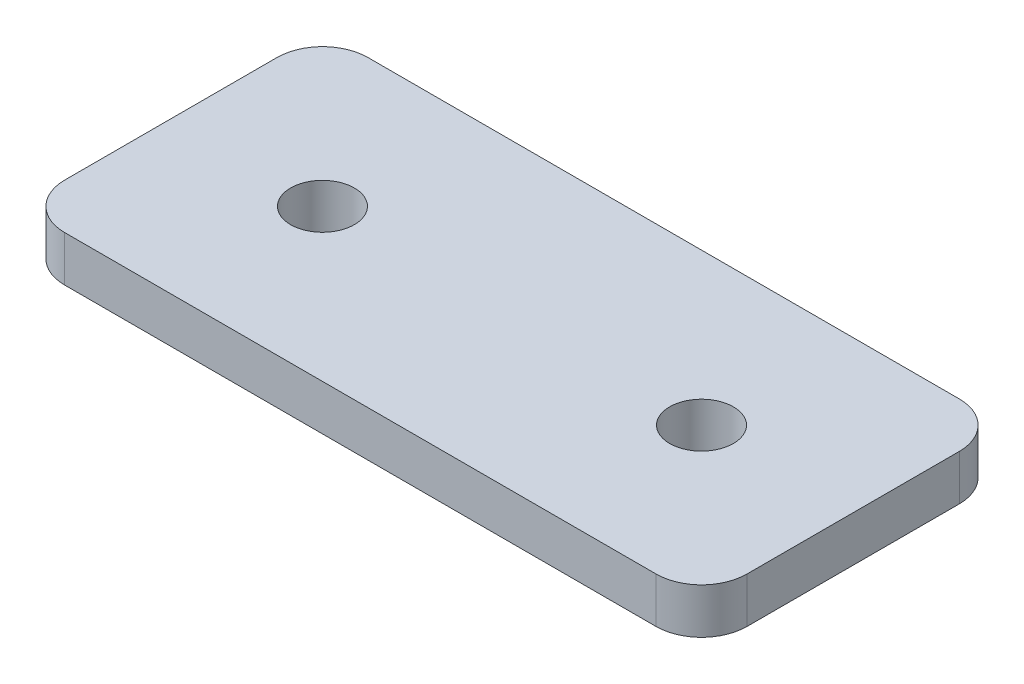
from build123d import *

# Parameters (mm, degrees)
SKETCH_1_W      = 45
SKETCH_1_H      = 20
SKETCH_1_R      = 2.1
EXTRUDE_1_DEPTH = 3
FILLET_1_R      = 3


with BuildPart() as part:
    # 草图1 → 凸台-拉伸1 (new body)
    with BuildSketch(Plane(origin=(0, 0, 0), x_dir=(1, 0, 0), z_dir=(0, 1, 0))):
        with Locations((12.5, 0)):
            Rectangle(SKETCH_1_W, SKETCH_1_H)
        with Locations(Location((0, 0, 0), (0, 0, 270))):
            Circle(SKETCH_1_R, mode=Mode.SUBTRACT)
        with Locations(Location((25, 0, 0), (0, 0, 270))):
            Circle(SKETCH_1_R, mode=Mode.SUBTRACT)
    extrude(amount=EXTRUDE_1_DEPTH)

    # 圆角1
    fillet_1_edges = [part.edges().sort_by_distance(p)[0] for p in [
        (35, 1.5, 10),
        (-10, 1.5, 10),
        (-10, 1.5, -10),
        (35, 1.5, -10),
    ]]
    fillet(fillet_1_edges, radius=FILLET_1_R)


solid = part.part
